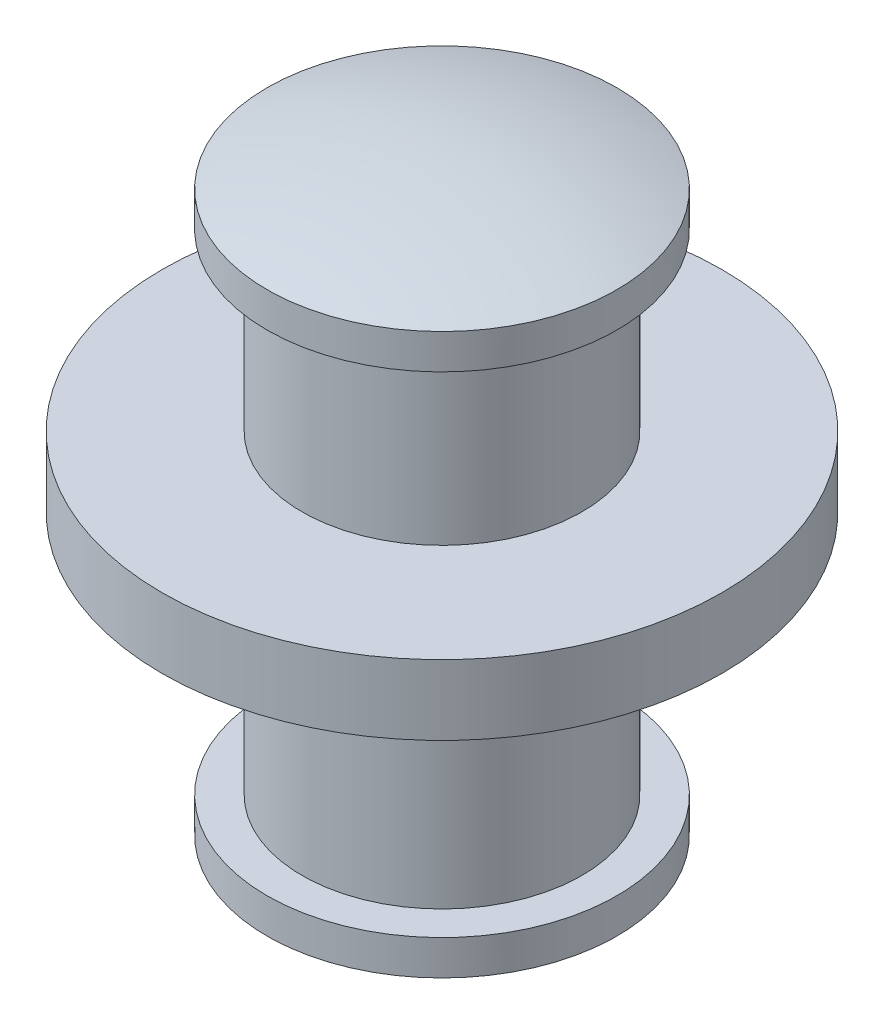
from build123d import *


with BuildPart() as part:
    # Esquisse1 → Base-Révolution (revolve)
    with BuildSketch(Plane.XY, mode=Mode.PRIVATE) as base_r_volution_sk:
        with BuildLine():
            Line((0, 0), (0, -0.650445183))
            ThreePointArc((0, -0.650445183), (-2.521065198, -0.487151674), (-5, 0))
            Line((-5, 0), (-5, 1))
            Line((-5, 1), (-4, 1))
            Line((-4, 1), (-4, 8))
            Line((-4, 8), (-8, 8))
            Line((-8, 8), (-8, 10))
            Line((-8, 10), (-4, 10))
            Line((-4, 10), (-4, 15))
            Line((-4, 15), (-5, 15))
            Line((-5, 15), (-5, 16))
            ThreePointArc((-5, 16), (-2.53207593, 16.601354724), (0, 16.803513576))
            Line((0, 16.803513576), (0, 16))
            Line((0, 16), (0, 0))
        make_face()
    revolve(base_r_volution_sk.sketch.rotate(Axis((0, 0, 0), (0, 1, 0)), 270), axis=Axis((0, 0, 0), (0, 1, 0)))


solid = part.part
